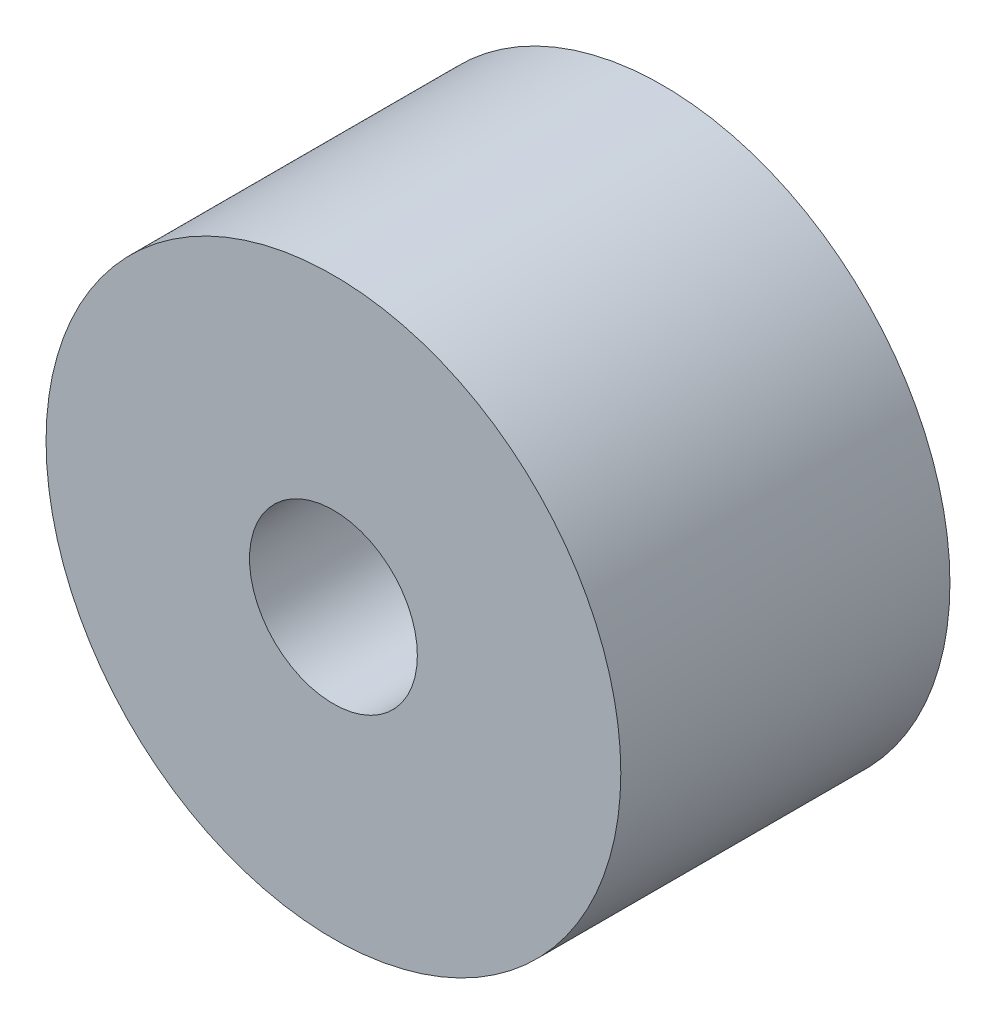
from build123d import *

# Parameters (mm, degrees)
SKETCH1_R           = 8.73125
SKETCH1_R_2         = 2.55
BOSS_EXTRUDE1_DEPTH = 10


with BuildPart() as part:
    # Sketch1 → Boss-Extrude1 (new body)
    with BuildSketch(Plane.XY):
        Circle(SKETCH1_R)
        Circle(SKETCH1_R_2, mode=Mode.SUBTRACT)
    extrude(amount=BOSS_EXTRUDE1_DEPTH)


solid = part.part
